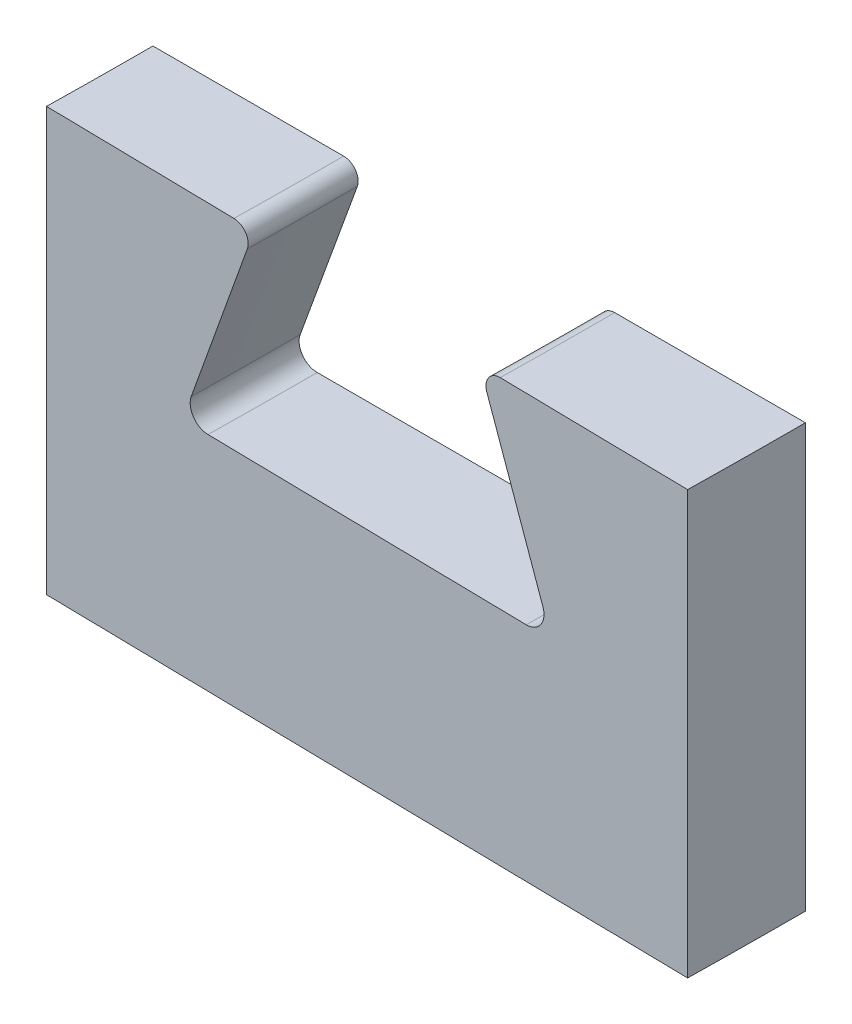
from build123d import *

# Parameters (mm, degrees)
REVOLVE1_ANGLE = 1


with BuildPart() as part:
    # Sketch1 → Revolve1 (revolve)
    with BuildSketch(Plane.XY):
        with BuildLine():
            Line((-6.858, 0), (6.858, 0))
            Line((6.858, 0), (6.858, 8.89))
            Line((6.858, 8.89), (2.848341014, 8.89))
            ThreePointArc((2.848341014, 8.89), (2.598655598, 8.76001488), (2.561932025, 8.480926511))
            Line((2.561932025, 8.480926511), (3.761907297, 5.1849418))
            ThreePointArc((3.761907297, 5.1849418), (3.716002836, 4.83608138), (3.403896102, 4.6736))
            Line((3.403896102, 4.6736), (-3.403896102, 4.6736))
            ThreePointArc((-3.403896102, 4.6736), (-3.716002836, 4.83608138), (-3.761907297, 5.1849418))
            Line((-3.761907297, 5.1849418), (-2.561932025, 8.480926511))
            ThreePointArc((-2.561932025, 8.480926511), (-2.598655598, 8.76001488), (-2.848341014, 8.89))
            Line((-2.848341014, 8.89), (-6.858, 8.89))
            Line((-6.858, 8.89), (-6.858, 0))
        make_face()
    revolve(axis=Axis((-133.858, 15.851032083, 0), (0, -1, 0)), revolution_arc=REVOLVE1_ANGLE)


solid = part.part
